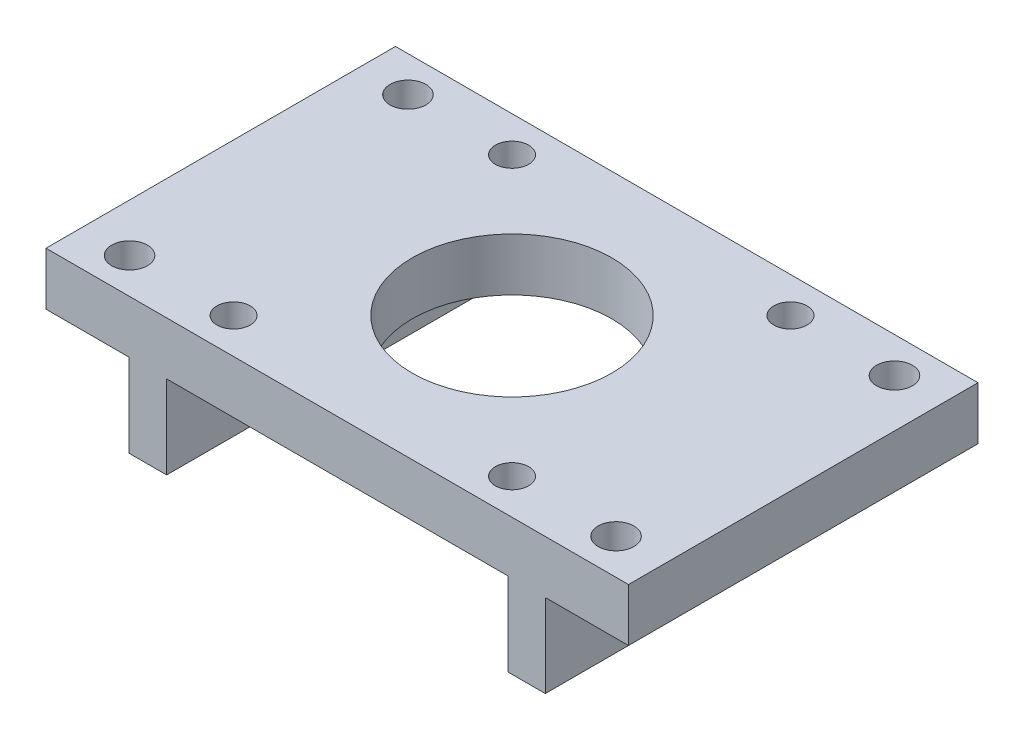
from build123d import *

# Parameters (mm, degrees)
SKETCH1_W             = 70
SKETCH1_H             = 42
BOSS_EXTRUDE1_DEPTH   = 3.175
SKETCH3_W             = 4.5
SKETCH3_H             = 42
BOSS_EXTRUDE2_DEPTH   = 10
F_1_0MM_DOWEL_HOLE1_D = 4
F_1_0MM_DOWEL_HOLE2_D = 4.3
SKETCH4_R             = 12
CUT_EXTRUDE1_DEPTH    = 44.969563336


with BuildPart() as part:
    # Sketch1 → Boss-Extrude1 (new, symmetric)
    with BuildSketch(Plane(origin=(0, 0, 0), x_dir=(1, 0, 0), z_dir=(0, 1, 0))):
        Rectangle(SKETCH1_W, SKETCH1_H)
    extrude(amount=BOSS_EXTRUDE1_DEPTH, both=True)

    # Sketch3 → Boss-Extrude2 (add)
    with BuildSketch(Plane.XZ.offset(3.175)):
        with Locations((-22.75, 0)):
            Rectangle(SKETCH3_W, SKETCH3_H)
        with Locations((22.75, 0)):
            Rectangle(SKETCH3_W, SKETCH3_H)
    extrude(amount=BOSS_EXTRUDE2_DEPTH)

    # Ø1.0mm Dowel Hole1 (through all)
    with Locations(Plane(origin=(0, 3.175, 0), x_dir=(1, 0, 0), z_dir=(0, 1, 0))):
        with Locations((-16.73, 16.73), (16.73, 16.73), (16.73, -16.73), (-16.73, -16.73)):
            Hole(F_1_0MM_DOWEL_HOLE1_D / 2)

    # Ø1.0mm Dowel Hole2 (through all)
    with Locations(Plane(origin=(0, 3.175, 0), x_dir=(1, 0, 0), z_dir=(0, 1, 0))):
        with Locations((-29.23, 16.73), (-29.23, -16.73)):
            f_1_0mm_dowel_hole2 = Hole(F_1_0MM_DOWEL_HOLE2_D / 2)

    # Mirror1: Ø1.0mm Dowel Hole2 across plane
    add(f_1_0mm_dowel_hole2.mirror(Plane(origin=(0, 0, 0), x_dir=(0, 0, 1), z_dir=(1, 0, 0))), mode=Mode.SUBTRACT)

    # Sketch4 → Cut-Extrude1 (cut, through all)
    with BuildSketch(Plane(origin=(0, 3.175, 0), x_dir=(1, 0, 0), z_dir=(0, 1, 0))):
        with Locations(Location((0, 0, 0), (0, 0, 270))):
            Circle(SKETCH4_R)
    extrude(amount=-CUT_EXTRUDE1_DEPTH, mode=Mode.SUBTRACT)


solid = part.part
